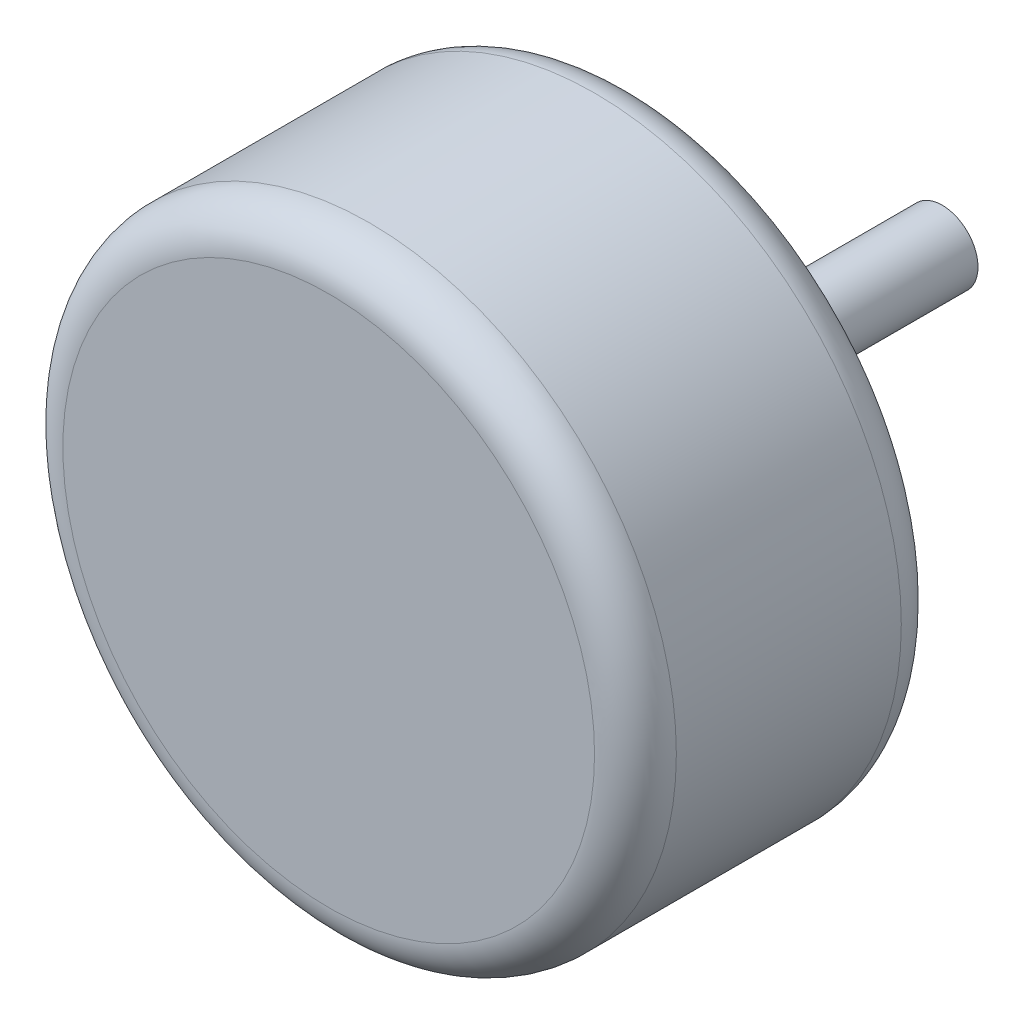
from build123d import *

# Parameters (mm, degrees)
SKETCH1_R           = 76.2
BOSS_EXTRUDE1_DEPTH = 76.2
SKETCH2_R           = 8.89
BOSS_EXTRUDE3_DEPTH = 76.2
FILLET1_R           = 10.16
FILLET2_R           = 10.16


with BuildPart() as part:
    # Sketch1 → Boss-Extrude1 (new body)
    with BuildSketch(Plane.XY):
        with Locations(Location((0, 0, 0), (0, 0, 180))):
            Circle(SKETCH1_R)
    extrude(amount=BOSS_EXTRUDE1_DEPTH)

    # Sketch2 → Boss-Extrude3 (add)
    with BuildSketch(Plane(origin=(0, 0, 0), x_dir=(-1, 0, 0), z_dir=(0, 0, -1))):
        with Locations(Location((0, 0, 0), (0, 0, 180))):
            Circle(SKETCH2_R)
    extrude(amount=BOSS_EXTRUDE3_DEPTH)

    # Fillet1
    fillet1_edges = [part.edges().sort_by_distance(p)[0] for p in [
        (76.2, 0, 76.2),
    ]]
    fillet(fillet1_edges, radius=FILLET1_R)

    # Fillet2
    fillet2_edges = [part.edges().sort_by_distance(p)[0] for p in [
        (76.2, 0, 0),
    ]]
    fillet(fillet2_edges, radius=FILLET2_R)


solid = part.part
